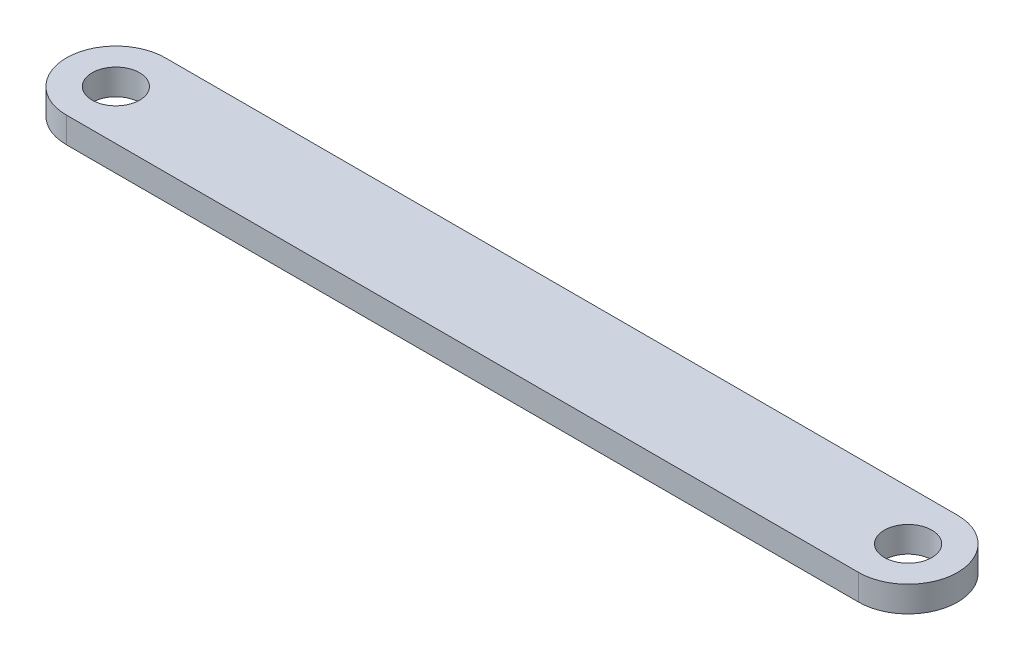
from build123d import *

# Parameters (mm, degrees)
SKETCH1_R           = 6
BOSS_EXTRUDE1_DEPTH = 6.5


with BuildPart() as part:
    # Sketch1 → Boss-Extrude1 (new body)
    with BuildSketch(Plane(origin=(0, 0, 0), x_dir=(1, 0, 0), z_dir=(0, 1, 0))):
        with BuildLine():
            Line((0, 12.5), (200, 12.5))
            ThreePointArc((200, 12.5), (212.5, 0), (200, -12.5))
            Line((200, -12.5), (0, -12.5))
            ThreePointArc((0, -12.5), (-12.5, 0), (0, 12.5))
        make_face()
        with Locations(Location((0, 0, 0), (0, 0, 90))):
            Circle(SKETCH1_R, mode=Mode.SUBTRACT)
        with Locations(Location((200, 0, 0), (0, 0, 90))):
            Circle(SKETCH1_R, mode=Mode.SUBTRACT)
    extrude(amount=BOSS_EXTRUDE1_DEPTH)


solid = part.part
